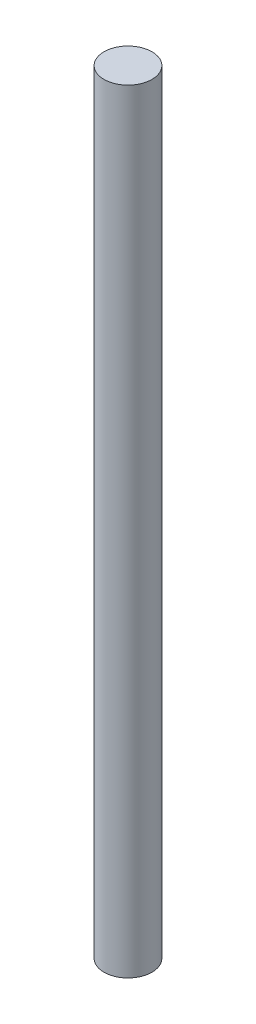
from build123d import *

# Parameters (mm, degrees)
SKETCH_1_R      = 1.55
EXTRUDE_1_DEPTH = 50


with BuildPart() as part:
    # 草图1 → 凸台-拉伸1 (new body)
    with BuildSketch(Plane(origin=(0, 0, 0), x_dir=(1, 0, 0), z_dir=(0, 1, 0))):
        with Locations(Location((0, 0, 0), (0, 0, 270))):
            Circle(SKETCH_1_R)
    extrude(amount=EXTRUDE_1_DEPTH)


solid = part.part
